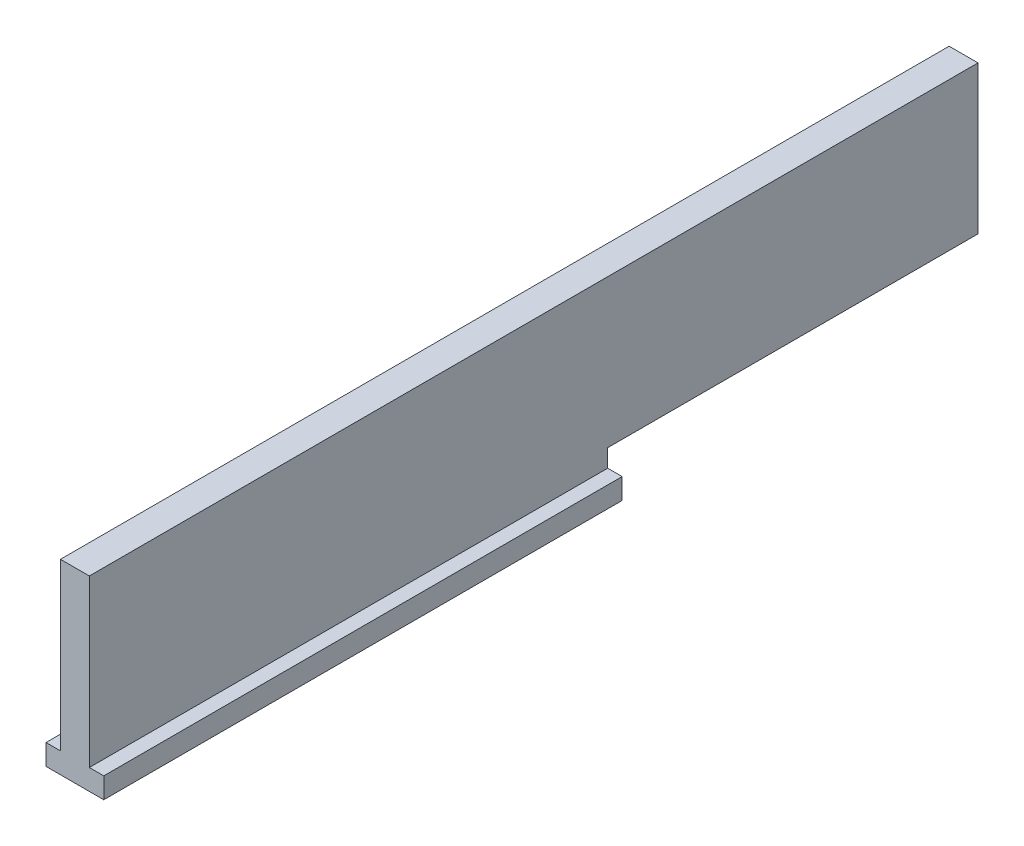
from build123d import *

# Parameters (mm, degrees)
SALIENTE_EXTRUIR1_DEPTH = 35
CROQUIS9_W              = 60
CROQUIS9_H              = 10
SALIENTE_EXTRUIR2_DEPTH = 0.975


with BuildPart() as part:
    # Croquis1 → Saliente-Extruir1 (new body)
    with BuildSketch(Plane.XY):
        Polygon((-1.95, -0.7), (-1.95, 0.7), (-0.975, 0.7), (-0.975, 1.9), (0.975, 1.9), (0.975, 0.7), (1.95, 0.7), (1.95, -0.7), align=None)
    extrude(amount=-SALIENTE_EXTRUIR1_DEPTH)

    # Croquis9 → Saliente-Extruir2 (add, symmetric)
    with BuildSketch(Plane(origin=(0, 0, 0), x_dir=(0, 0, -1), z_dir=(1, 0, 0))):
        with Locations((30, 6.9)):
            Rectangle(CROQUIS9_W, CROQUIS9_H)
    extrude(amount=SALIENTE_EXTRUIR2_DEPTH, both=True)


solid = part.part
